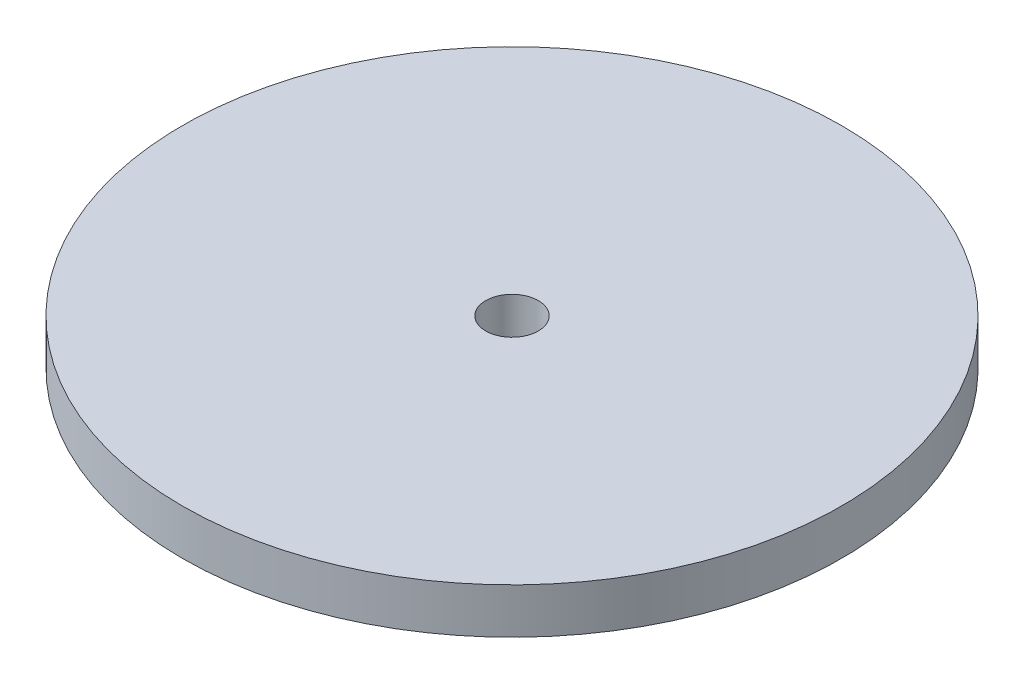
from build123d import *

# Parameters (mm, degrees)
SKETCH1_R           = 36.3
SKETCH1_R_2         = 2.9
BOSS_EXTRUDE1_DEPTH = 5


with BuildPart() as part:
    # Sketch1 → Boss-Extrude1 (new body)
    with BuildSketch(Plane(origin=(0, 0, 0), x_dir=(1, 0, 0), z_dir=(0, 1, 0))):
        with Locations(Location((0, 0, 0), (0, 0, 270))):
            Circle(SKETCH1_R)
        with Locations(Location((0, 0, 0), (0, 0, 270))):
            Circle(SKETCH1_R_2, mode=Mode.SUBTRACT)
    extrude(amount=BOSS_EXTRUDE1_DEPTH)


solid = part.part
